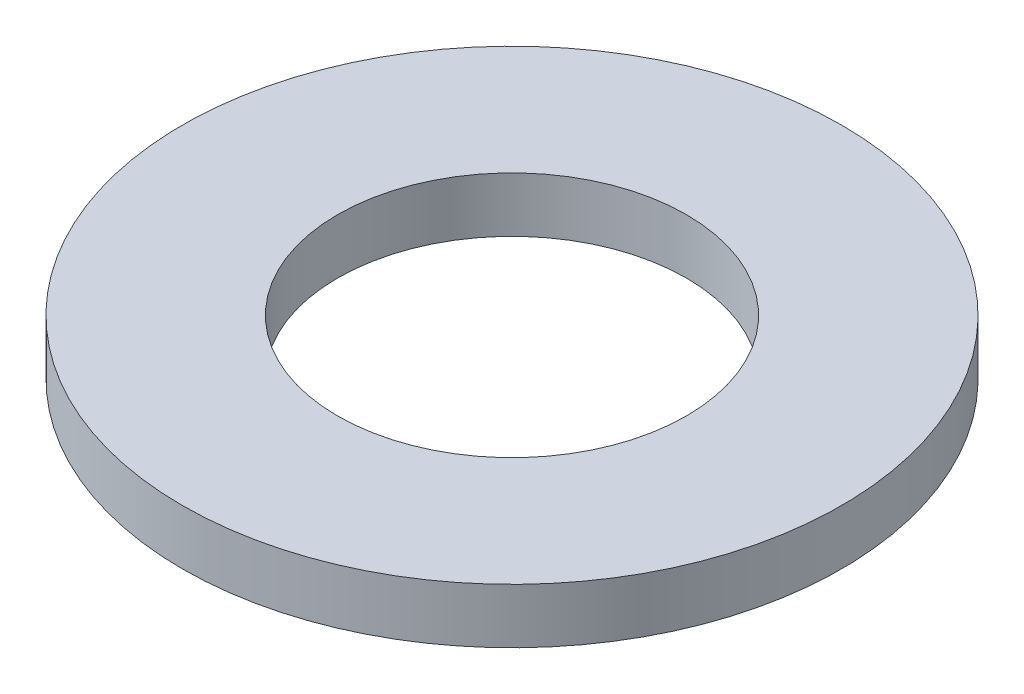
from build123d import *

# Parameters (mm, degrees)
SKETCH1_R           = 6
SKETCH1_R_2         = 3.175
BOSS_EXTRUDE1_DEPTH = 1


with BuildPart() as part:
    # Sketch1 → Boss-Extrude1 (new body)
    with BuildSketch(Plane(origin=(0, 0, 0), x_dir=(1, 0, 0), z_dir=(0, 1, 0))):
        with Locations(Location((0, 0, 0), (0, 0, 270))):
            Circle(SKETCH1_R)
        with Locations(Location((0, 0, 0), (0, 0, 270))):
            Circle(SKETCH1_R_2, mode=Mode.SUBTRACT)
    extrude(amount=BOSS_EXTRUDE1_DEPTH)


solid = part.part
